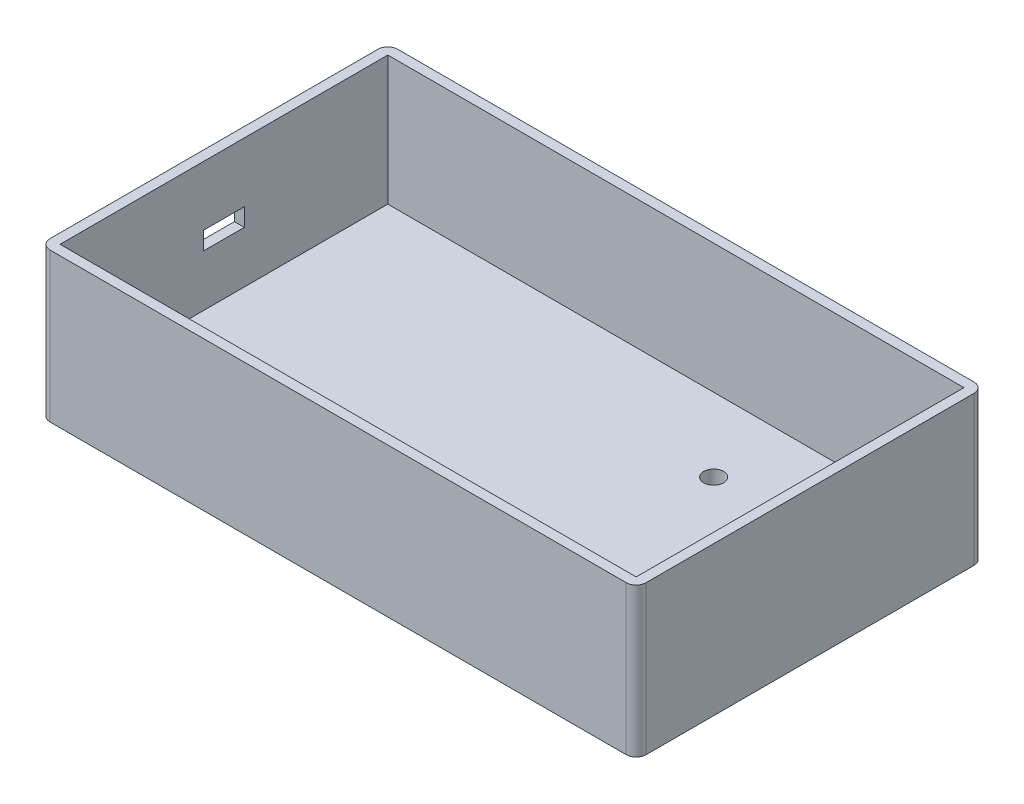
from build123d import *

# Parameters (mm, degrees)
SKETCH1_W           = 152.4
SKETCH1_H           = 88.9
BOSS_EXTRUDE1_DEPTH = 38.1
SKETCH2_W           = 147.32
SKETCH2_H           = 83.82
CUT_EXTRUDE1_DEPTH  = 33.02
SKETCH5_W           = 10.414
SKETCH5_H           = 4.572
CUT_EXTRUDE3_DEPTH  = 2.54
FILLET1_R           = 2.54
SKETCH6_R           = 2.54
CUT_EXTRUDE4_DEPTH  = 95.194282735


with BuildPart() as part:
    # Sketch1 → Boss-Extrude1 (new body)
    with BuildSketch(Plane(origin=(0, 0, 0), x_dir=(1, 0, 0), z_dir=(0, 1, 0))):
        Rectangle(SKETCH1_W, SKETCH1_H)
    extrude(amount=BOSS_EXTRUDE1_DEPTH)

    # Sketch2 → Cut-Extrude1 (cut)
    with BuildSketch(Plane(origin=(0, 38.1, 0), x_dir=(1, 0, 0), z_dir=(0, 1, 0))):
        Rectangle(SKETCH2_W, SKETCH2_H)
    extrude(amount=-CUT_EXTRUDE1_DEPTH, mode=Mode.SUBTRACT)

    # Sketch5 → Cut-Extrude3 (cut)
    with BuildSketch(Plane.ZY.offset(76.2)):
        with Locations((0, 20.574)):
            Rectangle(SKETCH5_W, SKETCH5_H)
    extrude(amount=-CUT_EXTRUDE3_DEPTH, mode=Mode.SUBTRACT)

    # Fillet1
    fillet1_edges = [part.edges().sort_by_distance(p)[0] for p in [
        (76.2, 19.05, 44.45),
        (-76.2, 19.05, 44.45),
        (-76.2, 19.05, -44.45),
        (76.2, 19.05, -44.45),
    ]]
    fillet(fillet1_edges, radius=FILLET1_R)

    # Sketch6 → Cut-Extrude4 (cut, through all)
    with BuildSketch(Plane(origin=(0, 5.08, 0), x_dir=(1, 0, 0), z_dir=(0, 1, 0))):
        with Locations(Location((28.448, 23.114, 0), (0, 0, 270))):
            Circle(SKETCH6_R)
        with Locations(Location((28.448, -23.114, 0), (0, 0, 90))):
            Circle(SKETCH6_R)
    extrude(amount=-CUT_EXTRUDE4_DEPTH, mode=Mode.SUBTRACT)


solid = part.part
